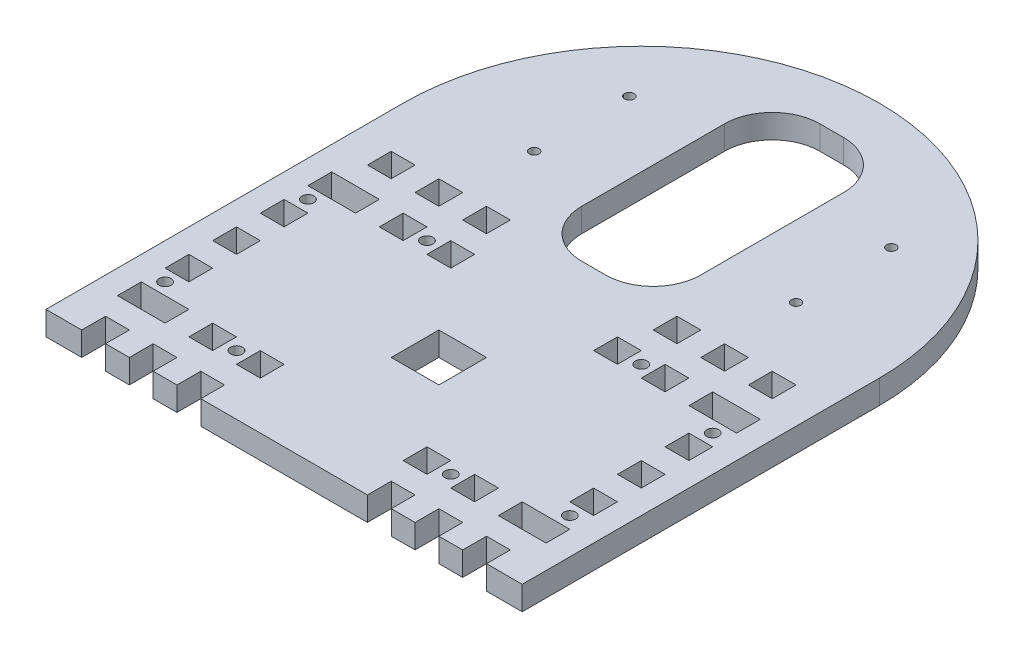
from build123d import *

# Parameters (mm, degrees)
BOSS_EXTRUDE1_DEPTH = 10
SKETCH2_R           = 2.5
SKETCH2_W           = 10
SKETCH2_H           = 10
SKETCH2_W_2         = 20
CUT_EXTRUDE1_DEPTH  = 202.804360706
SKETCH4_R           = 2
CUT_EXTRUDE2_DEPTH  = 202.804360706
SKETCH5_W           = 10
SKETCH5_H           = 10
SKETCH5_H_2         = 20
CUT_EXTRUDE3_DEPTH  = 202.804360706


with BuildPart() as part:
    # Sketch3 → Boss-Extrude1 (new body)
    with BuildSketch(Plane(origin=(0, 0, 0), x_dir=(1, 0, 0), z_dir=(0, 1, 0))):
        with BuildLine():
            Line((-100, -75), (100, -75))
            Line((100, -75), (100, 75))
            ThreePointArc((100, 75), (0, 175), (-100, 75))
            Line((-100, 75), (-100, -75))
        make_face()
    extrude(amount=BOSS_EXTRUDE1_DEPTH)

    # Sketch2 → Cut-Extrude1 (cut, through all)
    with BuildSketch(Plane(origin=(0, 10, 0), x_dir=(1, 0, 0), z_dir=(0, 1, 0))):
        with Locations(Location((45, 30, 0), (0, 0, 270))):
            Circle(SKETCH2_R)
        with Locations(Location((45, -50, 0), (0, 0, 270))):
            Circle(SKETCH2_R)
        with Locations(Location((85, -40, 0), (0, 0, 270))):
            Circle(SKETCH2_R)
        with Locations(Location((85, 20, 0), (0, 0, 270))):
            Circle(SKETCH2_R)
        with Locations((35, -50)):
            Rectangle(SKETCH2_W, SKETCH2_H)
        with Locations((55, -50)):
            Rectangle(SKETCH2_W, SKETCH2_H)
        with Locations((80, -50)):
            Rectangle(SKETCH2_W_2, SKETCH2_H)
        with Locations((85, -30)):
            Rectangle(SKETCH2_W, SKETCH2_H)
        with Locations((85, -10)):
            Rectangle(SKETCH2_W, SKETCH2_H)
        with Locations((85, 10)):
            Rectangle(SKETCH2_W, SKETCH2_H)
        with Locations((80, 30)):
            Rectangle(SKETCH2_W_2, SKETCH2_H)
        with Locations((55, 30)):
            Rectangle(SKETCH2_W, SKETCH2_H)
        with Locations((35, 30)):
            Rectangle(SKETCH2_W, SKETCH2_H)
    cut_extrude1 = extrude(amount=-CUT_EXTRUDE1_DEPTH, mode=Mode.SUBTRACT)

    # Mirror1: Cut-Extrude1 across plane
    add(cut_extrude1.mirror(Plane(origin=(0, 0, 0), x_dir=(0, 0, 1), z_dir=(1, 0, 0))), mode=Mode.SUBTRACT)

    # Sketch4 → Cut-Extrude2 (cut, through all)
    with BuildSketch(Plane(origin=(0, 10, 0), x_dir=(1, 0, 0), z_dir=(0, 1, 0))):
        with Locations(Location((55, 125, 0), (0, 0, 270))):
            Circle(SKETCH4_R)
        with Locations(Location((55, 85, 0), (0, 0, 270))):
            Circle(SKETCH4_R)
        with Locations(Location((-55, 125, 0), (0, 0, 270))):
            Circle(SKETCH4_R)
        with Locations(Location((-55, 85, 0), (0, 0, 270))):
            Circle(SKETCH4_R)
        with BuildLine():
            Line((-5, 155), (5, 155))
            ThreePointArc((5, 155), (19.142135624, 149.142135624), (25, 135))
            Line((25, 135), (25, 75))
            ThreePointArc((25, 75), (19.142135624, 60.857864376), (5, 55))
            Line((5, 55), (-5, 55))
            ThreePointArc((-5, 55), (-19.142135624, 60.857864376), (-25, 75))
            Line((-25, 75), (-25, 135))
            ThreePointArc((-25, 135), (-19.142135624, 149.142135624), (-5, 155))
        make_face()
    extrude(amount=-CUT_EXTRUDE2_DEPTH, mode=Mode.SUBTRACT)

    # Sketch5 → Cut-Extrude3 (cut, symmetric)
    with BuildSketch(Plane(origin=(0, 10, 0), x_dir=(1, 0, 0), z_dir=(0, 1, 0))):
        with Locations((80, 50)):
            Rectangle(SKETCH5_W, SKETCH5_H)
        with Locations((60, 50)):
            Rectangle(SKETCH5_W, SKETCH5_H)
        with Locations((40, 50)):
            Rectangle(SKETCH5_W, SKETCH5_H)
        with Locations((5, -10)):
            Rectangle(SKETCH5_W, SKETCH5_H_2)
        with Locations((40, -70)):
            Rectangle(SKETCH5_W, SKETCH5_H)
        with Locations((60, -70)):
            Rectangle(SKETCH5_W, SKETCH5_H)
        with Locations((80, -70)):
            Rectangle(SKETCH5_W, SKETCH5_H)
    cut_extrude3 = extrude(amount=CUT_EXTRUDE3_DEPTH, both=True, mode=Mode.SUBTRACT)

    # Mirror2: Cut-Extrude3 across plane
    add(cut_extrude3.mirror(Plane(origin=(0, 0, 0), x_dir=(0, 0, 1), z_dir=(1, 0, 0))), mode=Mode.SUBTRACT)


solid = part.part
